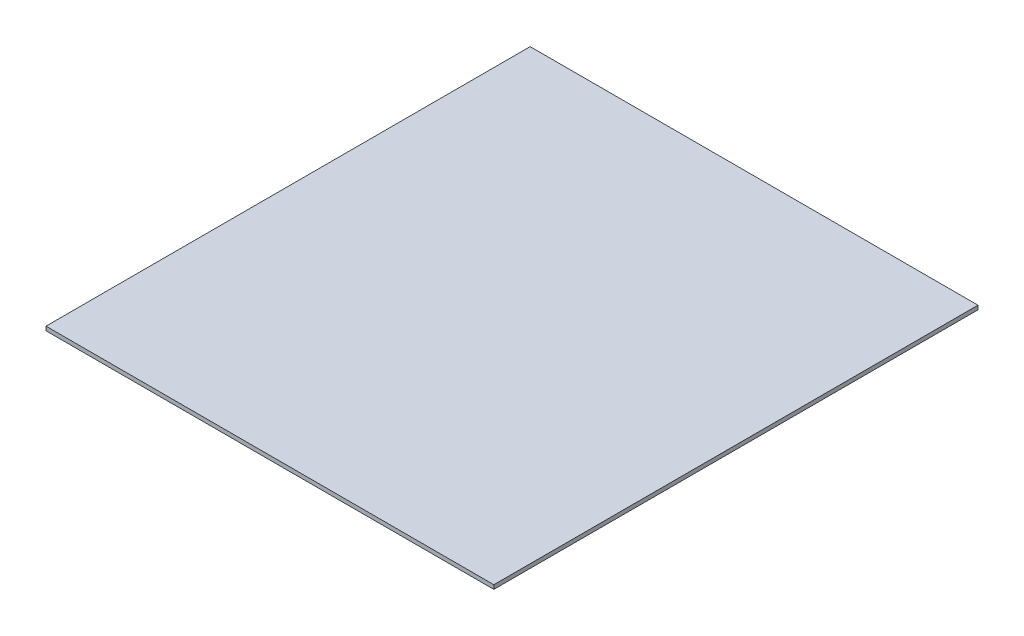
from build123d import *

# Parameters (mm, degrees)
SKETCH2_W           = 1110
SKETCH2_H           = 1200
BOSS_EXTRUDE1_DEPTH = 10


with BuildPart() as part:
    # Sketch2 → Boss-Extrude1 (new body)
    with BuildSketch(Plane(origin=(0, 0, 0), x_dir=(1, 0, 0), z_dir=(0, 1, 0))):
        Rectangle(SKETCH2_W, SKETCH2_H)
    extrude(amount=BOSS_EXTRUDE1_DEPTH)


solid = part.part
